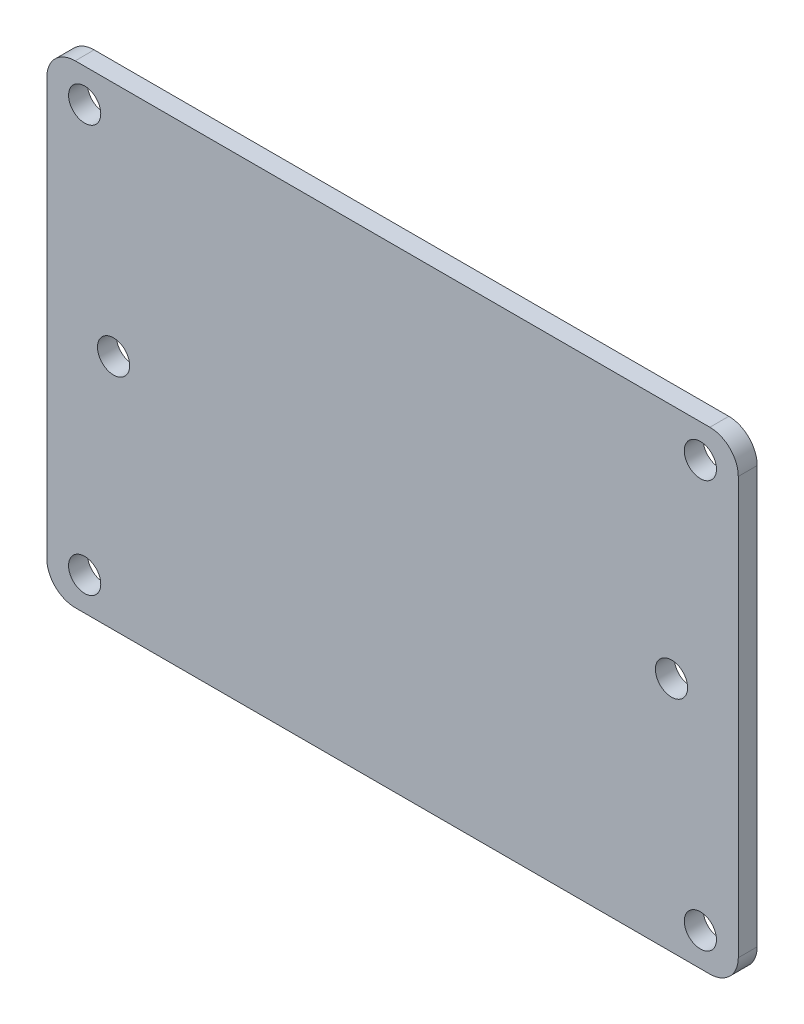
from build123d import *

# Parameters (mm, degrees)
SKETCH1_R           = 1.7
BOSS_EXTRUDE1_DEPTH = 2
CUT_EXTRUDE7_REACH  = 46.286
SKETCH3_R           = 1.7
SKETCH4_R           = 1.7
CUT_EXTRUDE8_DEPTH  = 45.286002303
SKETCH7_R           = 1.7
CUT_EXTRUDE9_DEPTH  = 45.286002303
CUT_EXTRUDE10_REACH = 46.286
SKETCH8_R           = 1.7


with BuildPart() as part:
    # Sketch1 → Boss-Extrude1 (new body)
    with BuildSketch(Plane.XY):
        with BuildLine():
            Line((-33.5, 25), (33.5, 25))
            ThreePointArc((33.5, 25), (35.621320344, 24.121320344), (36.5, 22))
            Line((36.5, 22), (36.5, -22))
            ThreePointArc((36.5, -22), (35.621320344, -24.121320344), (33.5, -25))
            Line((33.5, -25), (-33.5, -25))
            ThreePointArc((-33.5, -25), (-35.621320344, -24.121320344), (-36.5, -22))
            Line((-36.5, -22), (-36.5, 22))
            ThreePointArc((-36.5, 22), (-35.621320344, 24.121320344), (-33.5, 25))
        make_face()
        with Locations((-32.5, -21.5)):
            Circle(SKETCH1_R, mode=Mode.SUBTRACT)
    extrude(amount=BOSS_EXTRUDE1_DEPTH)

    # Sketch3 → Cut-Extrude7 (cut, up to next)
    with BuildSketch(Plane.XY, mode=Mode.PRIVATE) as cut_extrude7_sk1:
        with Locations((32.5, -21.5)):
            Circle(SKETCH3_R)
    cut_extrude7_tool1 = extrude(cut_extrude7_sk1.sketch, amount=CUT_EXTRUDE7_REACH, mode=Mode.PRIVATE) & part.part
    add(cut_extrude7_tool1.solids().sort_by_distance((32.5, -21.5, 0))[0], mode=Mode.SUBTRACT)

    # Sketch4 → Cut-Extrude8 (cut, through all)
    with BuildSketch(Plane.XY.offset(2)):
        with Locations((-32.5, 21.5)):
            Circle(SKETCH4_R)
    extrude(amount=-CUT_EXTRUDE8_DEPTH, mode=Mode.SUBTRACT)

    # Sketch7 → Cut-Extrude9 (cut, through all)
    with BuildSketch(Plane.XY.offset(2)):
        with Locations((32.5, 21.5)):
            Circle(SKETCH7_R)
    extrude(amount=-CUT_EXTRUDE9_DEPTH, mode=Mode.SUBTRACT)

    # Sketch8 → Cut-Extrude10 (cut, up to next)
    with BuildSketch(Plane(origin=(0, 0, 0), x_dir=(-1, 0, 0), z_dir=(0, 0, -1)), mode=Mode.PRIVATE) as cut_extrude10_sk1:
        with Locations((-29.45, 0)):
            Circle(SKETCH8_R)
    cut_extrude10_tool1 = extrude(cut_extrude10_sk1.sketch, amount=-CUT_EXTRUDE10_REACH, mode=Mode.PRIVATE) & part.part
    # Sketch8 → Cut-Extrude10 (cut, up to next)
    with BuildSketch(Plane(origin=(0, 0, 0), x_dir=(-1, 0, 0), z_dir=(0, 0, -1)), mode=Mode.PRIVATE) as cut_extrude10_sk2:
        with Locations((29.45, 0)):
            Circle(SKETCH8_R)
    cut_extrude10_tool2 = extrude(cut_extrude10_sk2.sketch, amount=-CUT_EXTRUDE10_REACH, mode=Mode.PRIVATE) & part.part
    add(cut_extrude10_tool1.solids().sort_by_distance((29.45, 0, 0))[0], mode=Mode.SUBTRACT)
    add(cut_extrude10_tool2.solids().sort_by_distance((-29.45, 0, 0))[0], mode=Mode.SUBTRACT)


solid = part.part
